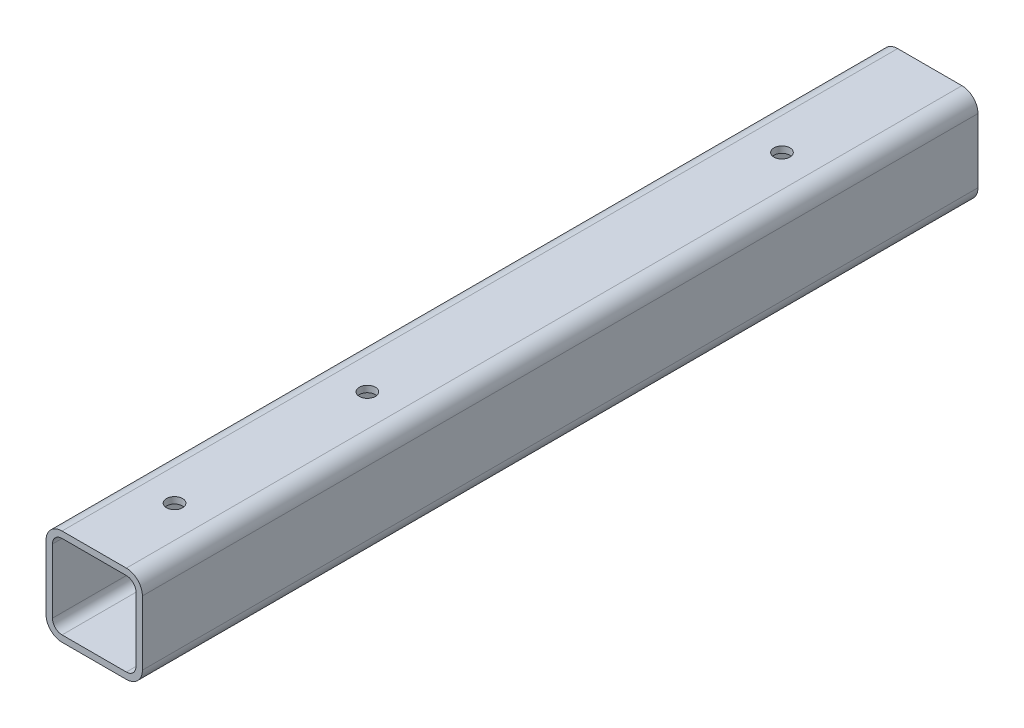
from build123d import *

# Parameters (mm, degrees)
AUFSATZ_LINEAR_AUSTRAGEN1_DEPTH = 130
SKIZZE2_R                       = 2.5
SCHNITT_LINEAR_AUSTRAGEN1_DEPTH = 60


with BuildPart() as part:
    # Skizze1 → Aufsatz-Linear austragen1 (new, symmetric)
    with BuildSketch(Plane.XY):
        with BuildLine():
            Line((-10, 15), (10, 15))
            ThreePointArc((10, 15), (13.535533906, 13.535533906), (15, 10))
            Line((15, 10), (15, -10))
            ThreePointArc((15, -10), (13.535533906, -13.535533906), (10, -15))
            Line((10, -15), (-10, -15))
            ThreePointArc((-10, -15), (-13.535533906, -13.535533906), (-15, -10))
            Line((-15, -10), (-15, 10))
            ThreePointArc((-15, 10), (-13.535533906, 13.535533906), (-10, 15))
        make_face()
        with BuildLine():
            Line((-13, 10), (-13, -10))
            ThreePointArc((-13, -10), (-12.121320344, -12.121320344), (-10, -13))
            Line((-10, -13), (10, -13))
            ThreePointArc((10, -13), (12.121320344, -12.121320344), (13, -10))
            Line((13, -10), (13, 10))
            ThreePointArc((13, 10), (12.121320344, 12.121320344), (10, 13))
            Line((10, 13), (-10, 13))
            ThreePointArc((-10, 13), (-12.121320344, 12.121320344), (-13, 10))
        make_face(mode=Mode.SUBTRACT)
    extrude(amount=AUFSATZ_LINEAR_AUSTRAGEN1_DEPTH, both=True)

    # Skizze2 → Schnitt-Linear austragen1 (cut)
    with BuildSketch(Plane.XZ.offset(15)):
        with Locations(Location((0, -84, 0), (0, 0, 270))):
            Circle(SKIZZE2_R)
        with Locations(Location((0, 105, 0), (0, 0, 270))):
            Circle(SKIZZE2_R)
        with Locations(Location((0, 45, 0), (0, 0, 270))):
            Circle(SKIZZE2_R)
    extrude(amount=-SCHNITT_LINEAR_AUSTRAGEN1_DEPTH, mode=Mode.SUBTRACT)


solid = part.part
